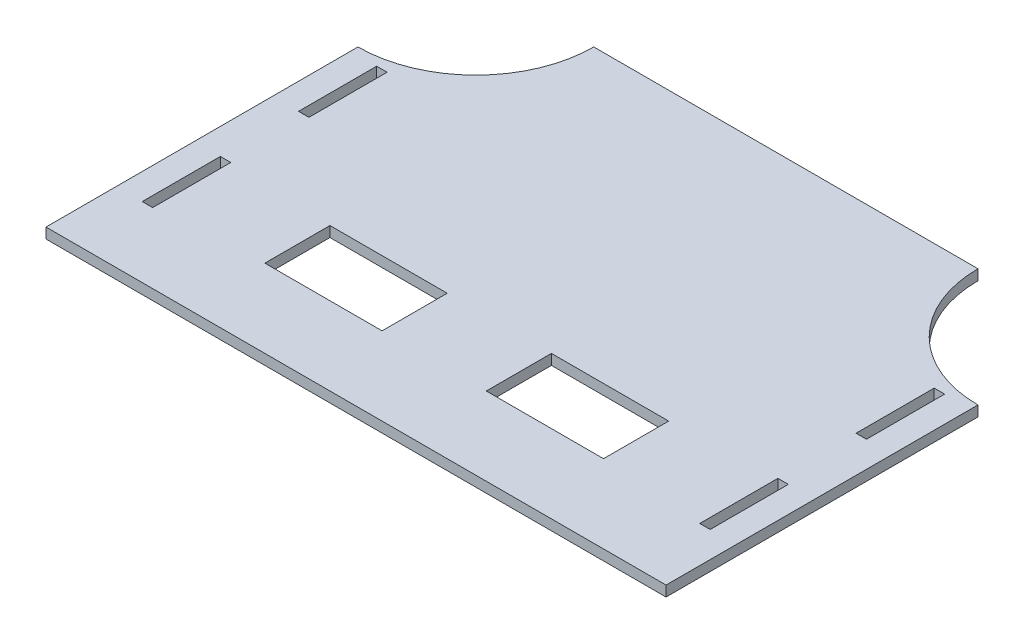
from build123d import *

# Parameters (mm, degrees)
SKETCH2_W           = 238
SKETCH2_H           = 165
BOSS_EXTRUDE1_DEPTH = 4
SKETCH3_W           = 4
SKETCH3_H           = 30
CUT_EXTRUDE1_DEPTH  = 290.629073126
SKETCH5_R           = 45.261498606
CUT_EXTRUDE3_DEPTH  = 10
SKETCH8_W           = 45
SKETCH8_H           = 25
CUT_EXTRUDE4_DEPTH  = 290.629073126


with BuildPart() as part:
    # Sketch2 → Boss-Extrude1 (new body)
    with BuildSketch(Plane(origin=(0, 0, 0), x_dir=(1, 0, 0), z_dir=(0, 1, 0))):
        with Locations((119, 82.5)):
            Rectangle(SKETCH2_W, SKETCH2_H)
    extrude(amount=BOSS_EXTRUDE1_DEPTH)

    # Sketch3 → Cut-Extrude1 (cut, through all)
    with BuildSketch(Plane(origin=(0, 4, 0), x_dir=(1, 0, 0), z_dir=(0, 1, 0))):
        with Locations((226, 101.931901068)):
            Rectangle(SKETCH3_W, SKETCH3_H)
        with Locations((226, 41.931901068)):
            Rectangle(SKETCH3_W, SKETCH3_H)
        with Locations((12, 101.931901068)):
            Rectangle(SKETCH3_W, SKETCH3_H)
        with Locations((12, 41.931901068)):
            Rectangle(SKETCH3_W, SKETCH3_H)
    extrude(amount=-CUT_EXTRUDE1_DEPTH, mode=Mode.SUBTRACT)

    # Sketch5 → Cut-Extrude3 (cut)
    with BuildSketch(Plane(origin=(0, 4, 0), x_dir=(1, 0, 0), z_dir=(0, 1, 0))):
        with Locations((238, 165)):
            Circle(SKETCH5_R)
        with Locations((0, 165)):
            Circle(SKETCH5_R)
    extrude(amount=-CUT_EXTRUDE3_DEPTH, mode=Mode.SUBTRACT)

    # Sketch8 → Cut-Extrude4 (cut, through all)
    with BuildSketch(Plane(origin=(0, 4, 0), x_dir=(1, 0, 0), z_dir=(0, 1, 0))):
        with Locations((76.5, 42.5)):
            Rectangle(SKETCH8_W, SKETCH8_H)
        with Locations((161.5, 42.5)):
            Rectangle(SKETCH8_W, SKETCH8_H)
    extrude(amount=-CUT_EXTRUDE4_DEPTH, mode=Mode.SUBTRACT)


solid = part.part
